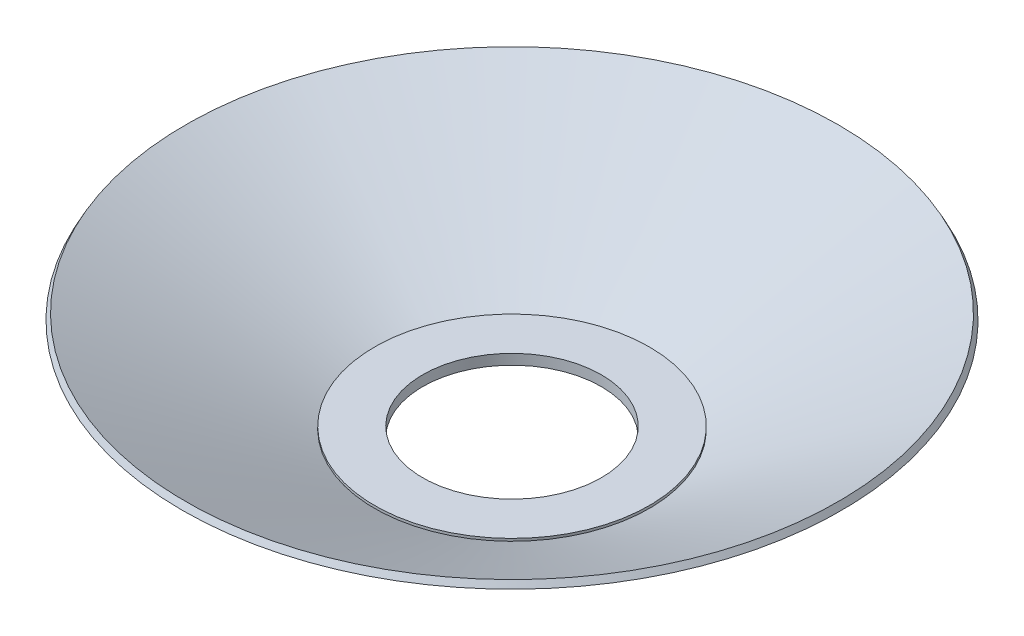
from build123d import *


with BuildPart() as part:
    # Эскиз1 → Повернуть1 (revolve)
    with BuildSketch(Plane.XY, mode=Mode.PRIVATE) as revolve_1_sk:
        Polygon((20, -0.367429949), (47.5, 14.254579421), (47.969471563, 13.371631829), (20, -1.5), (13, -1.5), (13, 0), (20, 0), align=None)
    revolve(revolve_1_sk.sketch.rotate(Axis((0, 0, 0), (0, 1, 0)), 90), axis=Axis((0, 0, 0), (0, 1, 0)))


solid = part.part
